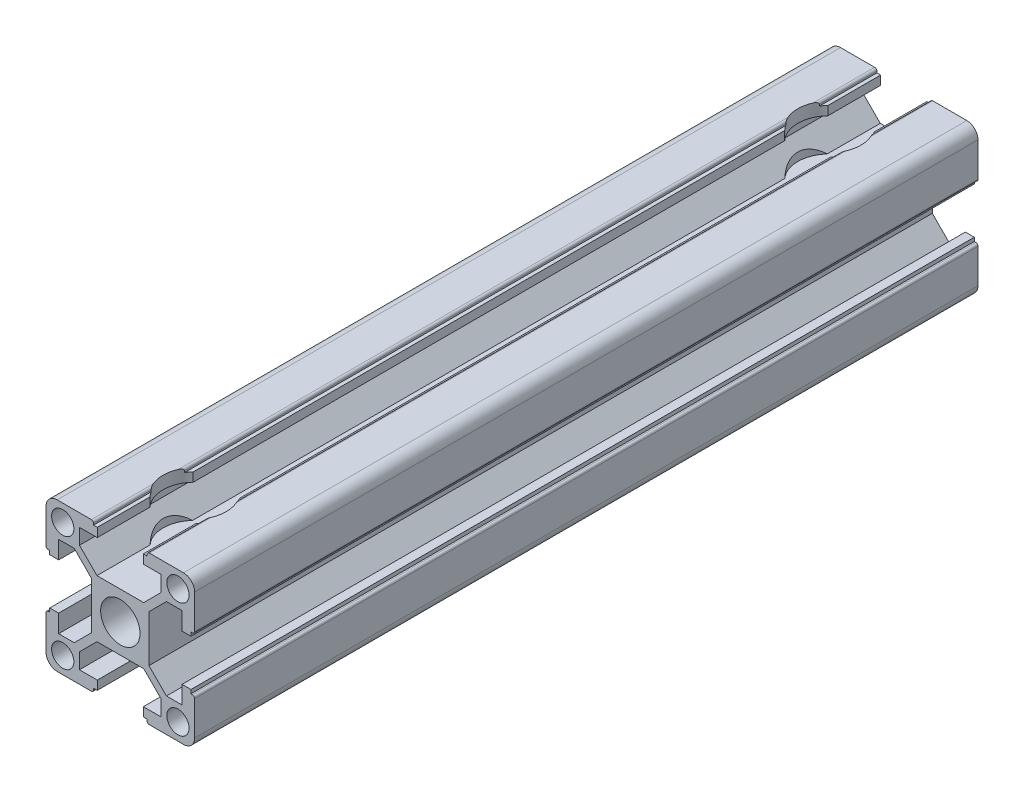
from build123d import *

# Parameters (mm, degrees)
SKETCH_1_R          = 2.65
SKETCH_1_R_2        = 1.5
EXTRUDE_1_DEPTH     = 52.7
SKETCH_2_R          = 2.1
CUT_EXTRUDE_1_DEPTH = 56.399571298
CUT_EXTRUDE_2_REACH = 57.4
SKETCH_3_R          = 4.25
SKETCH_4_R          = 2
CUT_EXTRUDE_3_DEPTH = 56.399571411


with BuildPart() as part:
    # 草图1 → 凸台-拉伸1 (new, symmetric)
    with BuildSketch(Plane.XY):
        with BuildLine():
            Line((3.142893219, 3.85), (-3.142893219, 3.85))
            Line((-3.142893219, 3.85), (-5.5, 6.207106781))
            Line((-5.5, 6.207106781), (-5.5, 8.3))
            Line((-5.5, 8.3), (-3.1, 8.3))
            Line((-3.1, 8.3), (-3.1, 9.5))
            Line((-3.1, 9.5), (-3.6, 9.5))
            Line((-3.6, 9.5), (-3.6, 9.7))
            ThreePointArc((-3.6, 9.7), (-3.687867966, 9.912132034), (-3.9, 10))
            Line((-3.9, 10), (-8.5, 10))
            ThreePointArc((-8.5, 10), (-9.560660172, 9.560660172), (-10, 8.5))
            Line((-10, 8.5), (-10, 3.9))
            ThreePointArc((-10, 3.9), (-9.912132034, 3.687867966), (-9.7, 3.6))
            Line((-9.7, 3.6), (-9.5, 3.6))
            Line((-9.5, 3.6), (-9.5, 3.1))
            Line((-9.5, 3.1), (-8.3, 3.1))
            Line((-8.3, 3.1), (-8.3, 5.5))
            Line((-8.3, 5.5), (-6.207106781, 5.5))
            Line((-6.207106781, 5.5), (-3.85, 3.142893219))
            Line((-3.85, 3.142893219), (-3.85, -3.142893219))
            Line((-3.85, -3.142893219), (-6.207106781, -5.5))
            Line((-6.207106781, -5.5), (-8.3, -5.5))
            Line((-8.3, -5.5), (-8.3, -3.1))
            Line((-8.3, -3.1), (-9.5, -3.1))
            Line((-9.5, -3.1), (-9.5, -3.6))
            Line((-9.5, -3.6), (-9.7, -3.6))
            ThreePointArc((-9.7, -3.6), (-9.912132034, -3.687867966), (-10, -3.9))
            Line((-10, -3.9), (-10, -8.5))
            ThreePointArc((-10, -8.5), (-9.560660172, -9.560660172), (-8.5, -10))
            Line((-8.5, -10), (-3.9, -10))
            ThreePointArc((-3.9, -10), (-3.687867966, -9.912132034), (-3.6, -9.7))
            Line((-3.6, -9.7), (-3.6, -9.5))
            Line((-3.6, -9.5), (-3.1, -9.5))
            Line((-3.1, -9.5), (-3.1, -8.3))
            Line((-3.1, -8.3), (-5.5, -8.3))
            Line((-5.5, -8.3), (-5.5, -6.207106781))
            Line((-5.5, -6.207106781), (-3.142893219, -3.85))
            Line((-3.142893219, -3.85), (3.142893219, -3.85))
            Line((3.142893219, -3.85), (5.5, -6.207106781))
            Line((5.5, -6.207106781), (5.5, -8.3))
            Line((5.5, -8.3), (3.1, -8.3))
            Line((3.1, -8.3), (3.1, -9.5))
            Line((3.1, -9.5), (3.6, -9.5))
            Line((3.6, -9.5), (3.6, -9.7))
            ThreePointArc((3.6, -9.7), (3.687867966, -9.912132034), (3.9, -10))
            Line((3.9, -10), (8.5, -10))
            ThreePointArc((8.5, -10), (9.560660172, -9.560660172), (10, -8.5))
            Line((10, -8.5), (10, -3.9))
            ThreePointArc((10, -3.9), (9.912132034, -3.687867966), (9.7, -3.6))
            Line((9.7, -3.6), (9.5, -3.6))
            Line((9.5, -3.6), (9.5, -3.1))
            Line((9.5, -3.1), (8.3, -3.1))
            Line((8.3, -3.1), (8.3, -5.5))
            Line((8.3, -5.5), (6.207106781, -5.5))
            Line((6.207106781, -5.5), (3.85, -3.142893219))
            Line((3.85, -3.142893219), (3.85, 3.142893219))
            Line((3.85, 3.142893219), (6.207106781, 5.5))
            Line((6.207106781, 5.5), (8.3, 5.5))
            Line((8.3, 5.5), (8.3, 3.1))
            Line((8.3, 3.1), (9.5, 3.1))
            Line((9.5, 3.1), (9.5, 3.6))
            Line((9.5, 3.6), (9.7, 3.6))
            ThreePointArc((9.7, 3.6), (9.912132034, 3.687867966), (10, 3.9))
            Line((10, 3.9), (10, 8.5))
            ThreePointArc((10, 8.5), (9.560660172, 9.560660172), (8.5, 10))
            Line((8.5, 10), (3.9, 10))
            ThreePointArc((3.9, 10), (3.687867966, 9.912132034), (3.6, 9.7))
            Line((3.6, 9.7), (3.6, 9.5))
            Line((3.6, 9.5), (3.1, 9.5))
            Line((3.1, 9.5), (3.1, 8.3))
            Line((3.1, 8.3), (5.5, 8.3))
            Line((5.5, 8.3), (5.5, 6.207106781))
            Line((5.5, 6.207106781), (3.142893219, 3.85))
        make_face()
        with Locations(Location((0, 0, 0), (0, 0, 180))):
            Circle(SKETCH_1_R, mode=Mode.SUBTRACT)
        with Locations(Location((-7.75, 7.75, 0), (0, 0, 180))):
            Circle(SKETCH_1_R_2, mode=Mode.SUBTRACT)
        with Locations(Location((7.75, 7.75, 0), (0, 0, 180))):
            Circle(SKETCH_1_R_2, mode=Mode.SUBTRACT)
        with Locations(Location((7.75, -7.75, 0), (0, 0, 180))):
            Circle(SKETCH_1_R_2, mode=Mode.SUBTRACT)
        with Locations(Location((-7.75, -7.75, 0), (0, 0, 180))):
            Circle(SKETCH_1_R_2, mode=Mode.SUBTRACT)
    extrude(amount=EXTRUDE_1_DEPTH, both=True)

    # 草图2 → 切除-拉伸1 (cut, through all)
    with BuildSketch(Plane.XZ.offset(3.85)):
        with Locations(Location((0, 42.7, 0), (0, 0, 270))):
            Circle(SKETCH_2_R)
        with Locations(Location((0, -42.7, 0), (0, 0, 270))):
            Circle(SKETCH_2_R)
    extrude(amount=-CUT_EXTRUDE_1_DEPTH, mode=Mode.SUBTRACT)

    # 切除-拉伸2: up to this face of the body (flat: up to its plane)
    cut_extrude_2_end = Plane(part.part.faces().sort_by_distance((6.2, 10, 0))[0])
    # 草图3 → 切除-拉伸2 (cut, up to the picked face)
    with BuildSketch(Plane(origin=(0, 3.85, 0), x_dir=(1, 0, 0), z_dir=(0, 1, 0)), mode=Mode.PRIVATE) as cut_extrude_2_sk1:
        with Locations((0, 42.7)):
            Circle(SKETCH_3_R)
    cut_extrude_2_tool1 = split(extrude(cut_extrude_2_sk1.sketch, amount=CUT_EXTRUDE_2_REACH, mode=Mode.PRIVATE), bisect_by=cut_extrude_2_end, keep=Keep.BOTH, mode=Mode.PRIVATE)
    # 草图3 → 切除-拉伸2 (cut, up to the picked face)
    with BuildSketch(Plane(origin=(0, 3.85, 0), x_dir=(1, 0, 0), z_dir=(0, 1, 0)), mode=Mode.PRIVATE) as cut_extrude_2_sk2:
        with Locations((0, -42.7)):
            Circle(SKETCH_3_R)
    cut_extrude_2_tool2 = split(extrude(cut_extrude_2_sk2.sketch, amount=CUT_EXTRUDE_2_REACH, mode=Mode.PRIVATE), bisect_by=cut_extrude_2_end, keep=Keep.BOTH, mode=Mode.PRIVATE)
    add(cut_extrude_2_tool1.solids().sort_by(Axis((0, 3.85, -42.7), (0, 1, 0)))[0], mode=Mode.SUBTRACT)
    add(cut_extrude_2_tool2.solids().sort_by(Axis((0, 3.85, 42.7), (0, 1, 0)))[0], mode=Mode.SUBTRACT)

    # 草图4 → 切除-拉伸3 (cut, through all)
    with BuildSketch(Plane(origin=(3.85, 0, 0), x_dir=(0, 0, -1), z_dir=(1, 0, 0))):
        with Locations((-38.1, 0)):
            Circle(SKETCH_4_R)
        with Locations((38.1, 0)):
            Circle(SKETCH_4_R)
    extrude(amount=-CUT_EXTRUDE_3_DEPTH, mode=Mode.SUBTRACT)


solid = part.part
